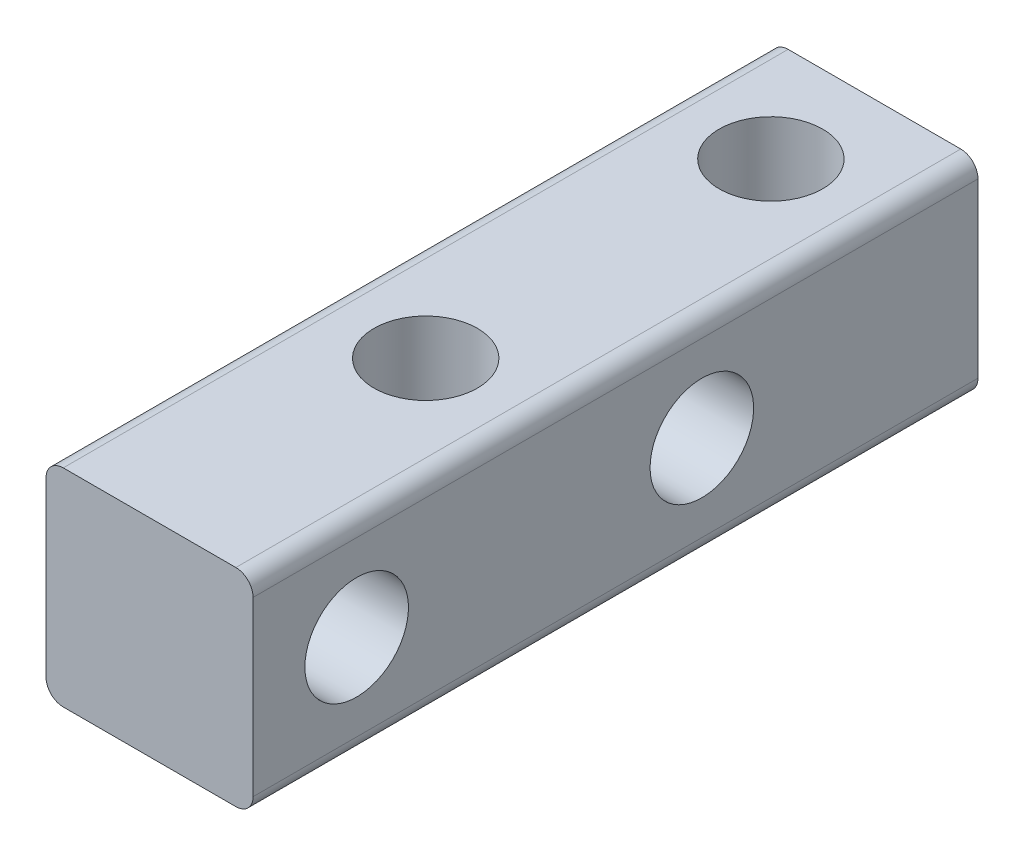
from build123d import *

# Parameters (mm, degrees)
SKETCH_1_W               = 6
SKETCH_1_H               = 6
EXTRUDE_1_DEPTH          = 21
CUT_EXTRUDE_1_DEPTH      = 21
CUT_EXTRUDE_1_DEPTH_BACK = 21
SKETCH_3_R               = 1.5
CUT_EXTRUDE_2_DEPTH      = 21
CUT_EXTRUDE_2_DEPTH_BACK = 21
SKETCH_4_R               = 1.5
FILLET_1_R               = 0.5


with BuildPart() as part:
    # 草图1 → 凸台-拉伸1 (new body)
    with BuildSketch(Plane.XY):
        Rectangle(SKETCH_1_W, SKETCH_1_H)
    extrude(amount=EXTRUDE_1_DEPTH)

    # 草图3 → 切除-拉伸1 (cut, two sides: drawn at the far end of the back side and taken through both)
    with BuildSketch(Plane(origin=(0, 0, 0), x_dir=(1, 0, 0), z_dir=(0, 1, 0)).offset(-CUT_EXTRUDE_1_DEPTH_BACK)):
        with Locations(Location((0, -3, 0), (0, 0, 90))):
            Circle(SKETCH_3_R)
        with Locations(Location((0, -13, 0), (0, 0, 90))):
            Circle(SKETCH_3_R)
    extrude(amount=CUT_EXTRUDE_1_DEPTH + CUT_EXTRUDE_1_DEPTH_BACK, mode=Mode.SUBTRACT)

    # 草图4 → 切除-拉伸2 (cut, two sides: drawn at the far end of the back side and taken through both)
    with BuildSketch(Plane(origin=(0, 0, 0), x_dir=(0, 0, -1), z_dir=(1, 0, 0)).offset(-CUT_EXTRUDE_2_DEPTH_BACK)):
        with Locations(Location((-18, 0, 0), (0, 0, 180))):
            Circle(SKETCH_4_R)
        with Locations(Location((-8, 0, 0), (0, 0, 180))):
            Circle(SKETCH_4_R)
    extrude(amount=CUT_EXTRUDE_2_DEPTH + CUT_EXTRUDE_2_DEPTH_BACK, mode=Mode.SUBTRACT)

    # 圆角1
    fillet_1_edges = [part.edges().sort_by_distance(p)[0] for p in [
        (3, -3, 10.5),
        (-3, -3, 10.5),
        (-3, 3, 10.5),
        (3, 3, 10.5),
    ]]
    fillet(fillet_1_edges, radius=FILLET_1_R)


solid = part.part
